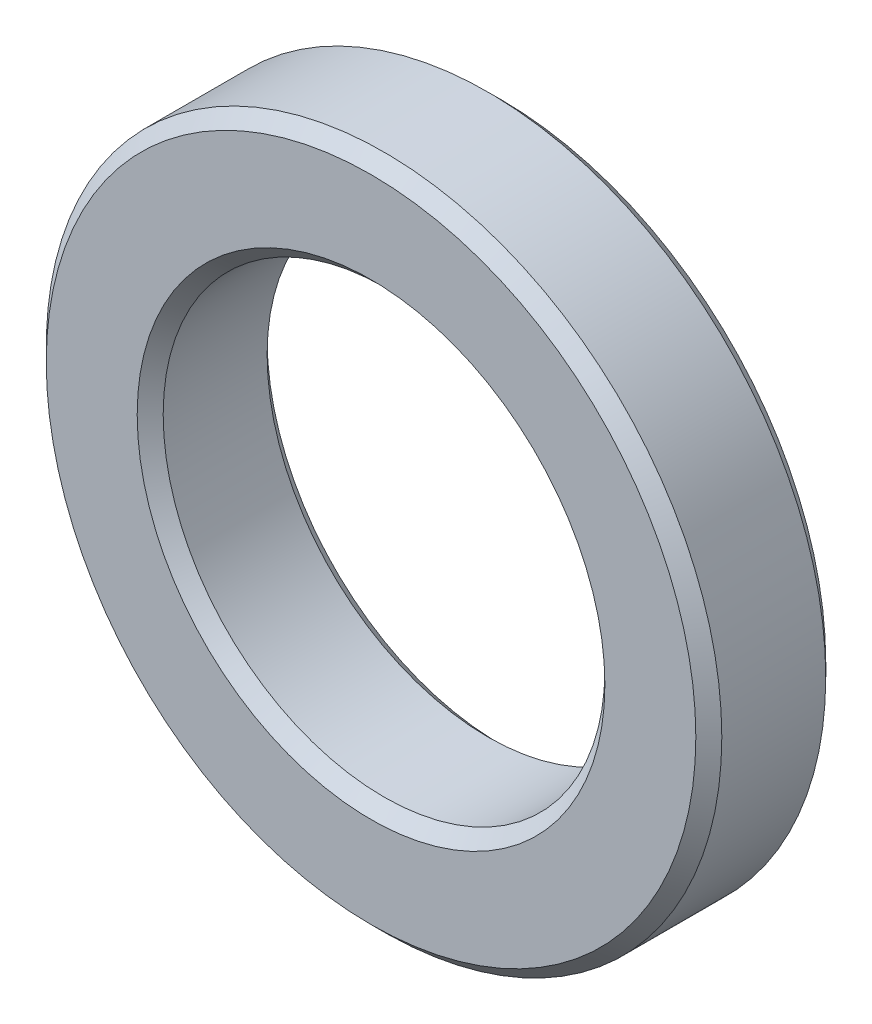
from build123d import *

# Parameters (mm, degrees)
SKETCH_1_R      = 13
SKETCH_1_R_2    = 8.5
EXTRUDE_1_DEPTH = 5
CHAMFER_1_SIZE  = 0.5


with BuildPart() as part:
    # 草图1 → 凸台-拉伸1 (new body)
    with BuildSketch(Plane.XY):
        Circle(SKETCH_1_R)
        Circle(SKETCH_1_R_2, mode=Mode.SUBTRACT)
    extrude(amount=EXTRUDE_1_DEPTH)

    # 倒角1
    chamfer_1_edges = [part.edges().sort_by_distance(p)[0] for p in [
        (-13, 0, 0),
        (-13, 0, 5),
        (-8.5, 0, 0),
        (-8.5, 0, 5),
    ]]
    chamfer(chamfer_1_edges, length=CHAMFER_1_SIZE)


solid = part.part
